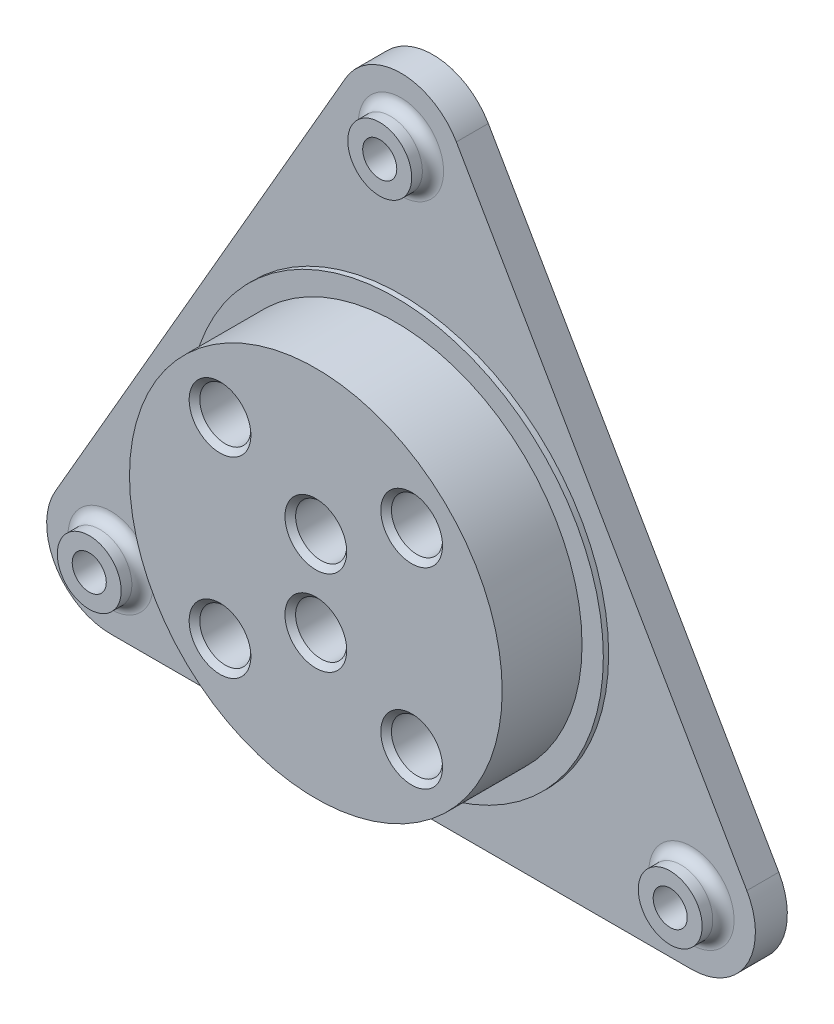
from build123d import *

# Parameters (mm, degrees)
SKETCH2_R           = 1.6
CUT_EXTRUDE1_DEPTH  = 65.58327957
SKETCH3_R           = 2.4
CUT_EXTRUDE2_DEPTH  = 4
SKETCH5_OUTSIDE_W   = 117.55
SKETCH5_OUTSIDE_H   = 117.55
CUT_EXTRUDE4_DEPTH  = 65.140470843
CHAMFER1_SIZE       = 0.5
SKETCH6_R           = 3
SKETCH6_R_2         = 1.6
BOSS_EXTRUDE1_DEPTH = 2
FILLET1_R           = 1
SKETCH7_R           = 1.75
CUT_EXTRUDE5_DEPTH  = 6


with BuildPart() as part:
    # Sketch1 → Revolve1 (revolve)
    with BuildSketch(Plane(origin=(0, 0, 0), x_dir=(0, 0, -1), z_dir=(1, 0, 0)), mode=Mode.PRIVATE) as revolve1_sk:
        Polygon((0, 0), (0, 45), (-3, 45), (-3, 19.5), (-3.5, 19.5), (-3.5, 17.5), (-11, 17.5), (-11, 0), align=None)
    revolve(revolve1_sk.sketch.rotate(Axis((0, 0, 11), (0, 0, -1)), 90), axis=Axis((0, 0, 11), (0, 0, -1)))

    # Sketch2 → Cut-Extrude1 (cut, through all)
    with BuildSketch(Plane(origin=(0, 0, 0), x_dir=(-1, 0, 0), z_dir=(0, 0, -1))):
        with Locations(Location((0, 31.5, 0), (0, 0, 90))):
            Circle(SKETCH2_R)
        with Locations(Location((27.279800219, -15.75, 0), (0, 0, 90))):
            Circle(SKETCH2_R)
        with Locations(Location((-27.279800219, -15.75, 0), (0, 0, 90))):
            Circle(SKETCH2_R)
    extrude(amount=-CUT_EXTRUDE1_DEPTH, mode=Mode.SUBTRACT)

    # Sketch3 → Cut-Extrude2 (cut)
    with BuildSketch(Plane.XY.offset(11)):
        with Locations((0, 4)):
            Circle(SKETCH3_R)
        with Locations((0, -4)):
            Circle(SKETCH3_R)
        with Locations((-9, 9)):
            Circle(SKETCH3_R)
        with Locations((9, 9)):
            Circle(SKETCH3_R)
        with Locations((9, -9)):
            Circle(SKETCH3_R)
        with Locations((-9, -9)):
            Circle(SKETCH3_R)
    extrude(amount=-CUT_EXTRUDE2_DEPTH, mode=Mode.SUBTRACT)

    # Sketch5 outside → Cut-Extrude4 (cut, through all)
    with BuildSketch(Plane(origin=(0, 0, 3), x_dir=(-1, 0, 0), z_dir=(0, 0, -1))):
        Rectangle(SKETCH5_OUTSIDE_W, SKETCH5_OUTSIDE_H)
        with BuildLine():
            Line((-5.196152423, 34.5), (-32.475952642, -12.75))
            ThreePointArc((-32.475952642, -12.75), (-32.475952642, -18.75), (-27.279800219, -21.75))
            Line((-27.279800219, -21.75), (27.279800219, -21.75))
            ThreePointArc((27.279800219, -21.75), (32.475952642, -18.75), (32.475952642, -12.75))
            Line((32.475952642, -12.75), (5.196152423, 34.5))
            ThreePointArc((5.196152423, 34.5), (0, 37.5), (-5.196152423, 34.5))
        make_face(mode=Mode.SUBTRACT)
    extrude(amount=CUT_EXTRUDE4_DEPTH, mode=Mode.SUBTRACT)

    # Chamfer1
    chamfer1_edges = [part.edges().sort_by_distance(p)[0] for p in [
        (-2.4, -4, 11),
        (-11.4, 9, 11),
        (6.6, 9, 11),
        (6.6, -9, 11),
        (-11.4, -9, 11),
        (-2.4, 4, 11),
    ]]
    chamfer(chamfer1_edges, length=CHAMFER1_SIZE)

    # Sketch6 → Boss-Extrude1 (add)
    # profile 1 of 3: a face of its own
    with BuildSketch(Plane.XY.offset(3)):
        with Locations(Location((0, 31.5, 0), (0, 0, 180))):
            Circle(SKETCH6_R)
        with Locations(Location((0, 31.5, 0), (0, 0, 90))):
            Circle(SKETCH6_R_2, mode=Mode.SUBTRACT)
    # profile 2 of 3: a face of its own
    with BuildSketch(Plane.XY.offset(3)):
        with Locations(Location((-27.279800219, -15.75, 0), (0, 0, 180))):
            Circle(SKETCH6_R)
        with Locations(Location((-27.279800219, -15.75, 0), (0, 0, 90))):
            Circle(SKETCH6_R_2, mode=Mode.SUBTRACT)
    # profile 3 of 3: a face of its own
    with BuildSketch(Plane.XY.offset(3)):
        with Locations(Location((27.279800219, -15.75, 0), (0, 0, 180))):
            Circle(SKETCH6_R)
        with Locations(Location((27.279800219, -15.75, 0), (0, 0, 90))):
            Circle(SKETCH6_R_2, mode=Mode.SUBTRACT)
    extrude(amount=BOSS_EXTRUDE1_DEPTH)

    # Fillet1
    fillet1_edges = [part.edges().sort_by_distance(p)[0] for p in [
        (30.279800219, -15.75, 3),
        (-24.279800219, -15.75, 3),
        (3, 31.5, 3),
    ]]
    fillet(fillet1_edges, radius=FILLET1_R)

    # Sketch7 → Cut-Extrude5 (cut)
    with BuildSketch(Plane.XY.offset(11)):
        with Locations((-9, 9)):
            Circle(SKETCH7_R)
        with Locations((0, 4)):
            Circle(SKETCH7_R)
        with Locations((9, 9)):
            Circle(SKETCH7_R)
        with Locations((9, -9)):
            Circle(SKETCH7_R)
        with Locations((-9, -9)):
            Circle(SKETCH7_R)
        with Locations((0, -4)):
            Circle(SKETCH7_R)
    extrude(amount=-CUT_EXTRUDE5_DEPTH, mode=Mode.SUBTRACT)


solid = part.part
